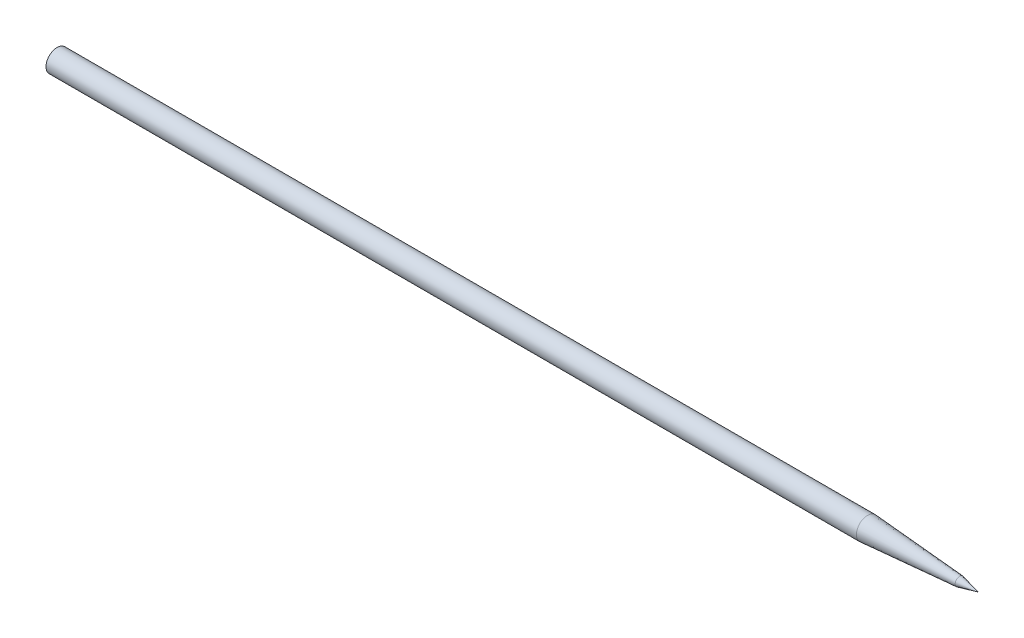
from build123d import *


with BuildPart() as part:
    # Sketch1 → Revolve1 (revolve)
    with BuildSketch(Plane.XY, mode=Mode.PRIVATE) as revolve1_sk:
        Polygon((0, 0), (0, 3), (220, 3), (245, 1.2), (250, 0), align=None)
    revolve(revolve1_sk.sketch.rotate(Axis((-10, 0, 0), (1, 0, 0)), 90), axis=Axis((-10, 0, 0), (1, 0, 0)))


solid = part.part
